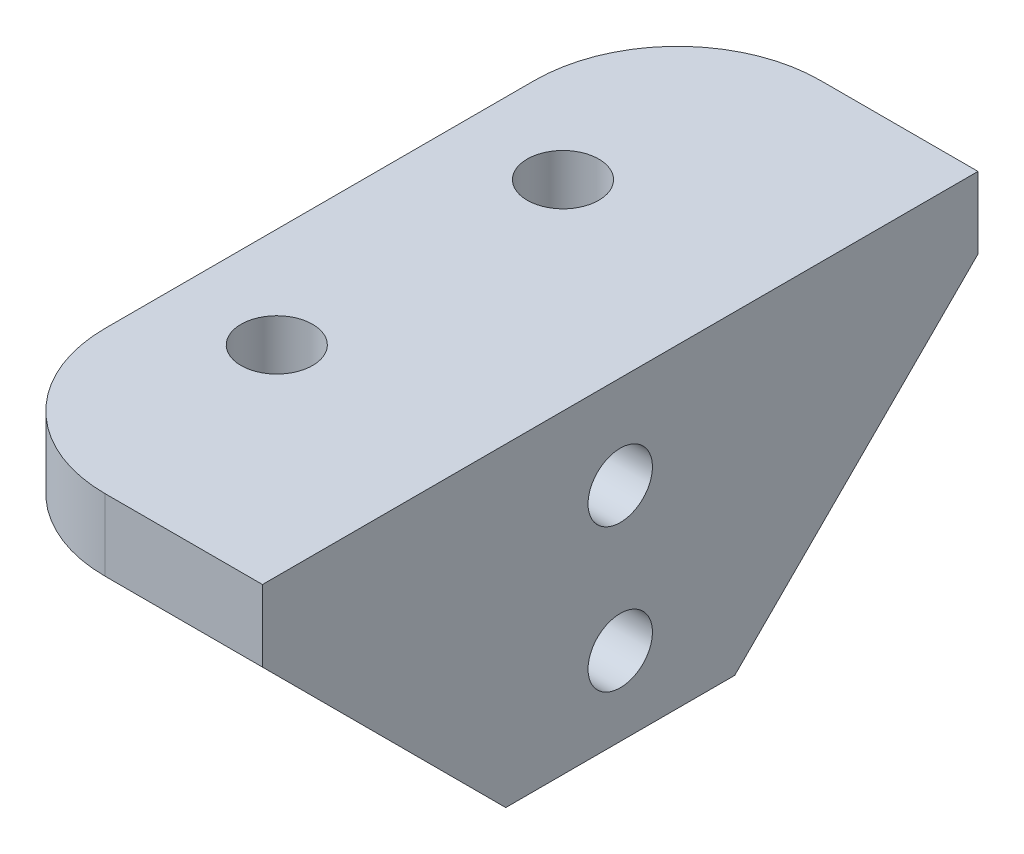
from build123d import *

# Parameters (mm, degrees)
ESBO_O1_W                                    = 15
ESBO_O1_H                                    = 50
RESSALTO_EXTRUS_O1_DEPTH                     = 5
ESBO_O2_R                                    = 2.5
CORTE_EXTRUS_O1_DEPTH                        = 53.440442409
FILETE1_R                                    = 10
RESSALTO_EXTRUS_O2_DEPTH                     = 6
REBAIXO_PARA_PARAFUSO_COM_CABE_A_RED_2_COUNT = 2
REBAIXO_PARA_PARAFUSO_COM_CABE_A_RED_2_PITCH = 10


with BuildPart() as part:
    # Esboço1 → Ressalto-extrusão1 (new body)
    with BuildSketch(Plane(origin=(0, 0, 0), x_dir=(1, 0, 0), z_dir=(0, 1, 0))):
        with Locations((7.5, 25)):
            Rectangle(ESBO_O1_W, ESBO_O1_H)
    extrude(amount=RESSALTO_EXTRUS_O1_DEPTH)

    # Esboço2 → Corte-extrusão1 (cut, through all)
    with BuildSketch(Plane(origin=(0, 5, 0), x_dir=(1, 0, 0), z_dir=(0, 1, 0))):
        with Locations(Location((7, 35, 0), (0, 0, 270))):
            Circle(ESBO_O2_R)
        with Locations(Location((7, 15, 0), (0, 0, 270))):
            Circle(ESBO_O2_R)
    extrude(amount=-CORTE_EXTRUS_O1_DEPTH, mode=Mode.SUBTRACT)

    # Filete1
    filete1_edges = [part.edges().sort_by_distance(p)[0] for p in [
        (0, 2.5, -50),
        (0, 2.5, 0),
    ]]
    fillet(filete1_edges, radius=FILETE1_R)

    # Esboço3 → Ressalto-extrusão2 (add)
    with BuildSketch(Plane(origin=(15, 0, 0), x_dir=(0, 0, -1), z_dir=(1, 0, 0))):
        Polygon((50, 5), (0, 5), (0, 0), (17, -17), (33, -17), (50, 0), align=None)
    extrude(amount=RESSALTO_EXTRUS_O2_DEPTH)

    # Esboço6 → Rebaixo para parafuso com cabeça redonda de M41 (revolve, cut)
    with BuildSketch(Plane(origin=(15, -11.5, -25), x_dir=(0, 0, 1), z_dir=(0, 1, 0))):
        Polygon((0, 0), (0, 6), (2.25, 6), (2.25, 2.6), (4, 2.6), (4, 0.025), (4.025, 0), align=None)
    rebaixo_para_parafuso_com_cabe_a_redonda = revolve(axis=Axis((8.65, -11.5, -25), (1, 0, 0)), mode=Mode.SUBTRACT)

    # Rebaixo para parafuso com cabe_a red 2: Rebaixo para parafuso com cabeça redonda de M41 ×2
    with Locations(*[(0, i * REBAIXO_PARA_PARAFUSO_COM_CABE_A_RED_2_PITCH, 0) for i in range(1, REBAIXO_PARA_PARAFUSO_COM_CABE_A_RED_2_COUNT)]):
        add(rebaixo_para_parafuso_com_cabe_a_redonda, mode=Mode.SUBTRACT)


solid = part.part
